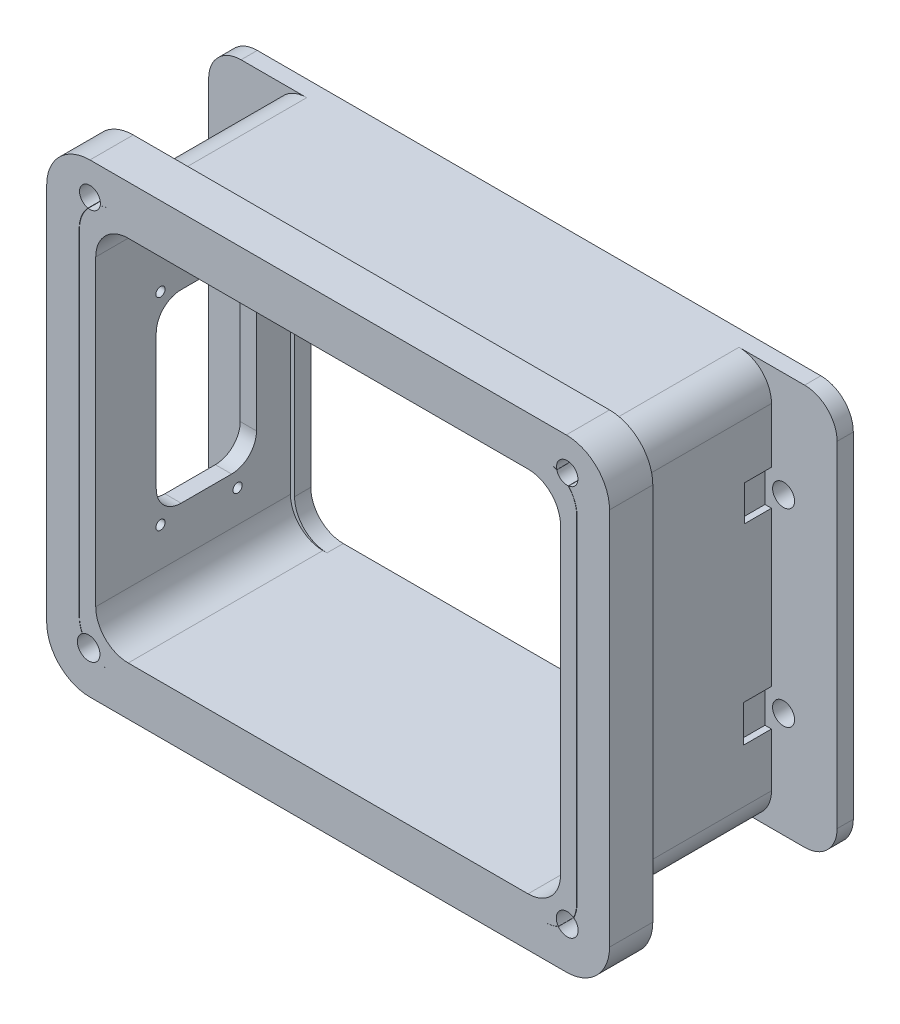
from build123d import *

# Parameters (mm, degrees)
BOSS_EXTRUDE1_DEPTH = 3.81
BOSS_EXTRUDE2_DEPTH = 45.72
CUT_EXTRUDE1_REACH  = 100.694
SKETCH4_R           = 2.58
CUT_EXTRUDE2_REACH  = 150.732
CUT_EXTRUDE3_REACH  = 147.358
SKETCH8_R           = 1.085
SKETCH10_W          = 6.281419417
SKETCH10_H          = 8.338567611
SKETCH10_W_2        = 6.611751911
SKETCH10_H_2        = 8.662901092
CUT_EXTRUDE4_DEPTH  = 1.524
BOSS_EXTRUDE3_DEPTH = 10.16
SKETCH12_R          = 2.447521694
SKETCH12_R_2        = 2.570723965
SKETCH12_R_3        = 2.649131916
SKETCH12_R_4        = 2.514751493
CUT_EXTRUDE5_DEPTH  = 5.08


with BuildPart() as part:
    # Sketch1 → Boss-Extrude1 (new body)
    with BuildSketch(Plane.XY):
        with BuildLine():
            Line((66.150214266, -46.99), (-66.150214266, -46.99))
            ThreePointArc((-66.150214266, -46.99), (-71.538367938, -44.758153673), (-73.770214266, -39.37))
            Line((-73.770214266, -39.37), (-73.770214266, 39.37))
            ThreePointArc((-73.770214266, 39.37), (-71.538367938, 44.758153673), (-66.150214266, 46.99))
            Line((-66.150214266, 46.99), (66.150214266, 46.99))
            ThreePointArc((66.150214266, 46.99), (71.538367938, 44.758153673), (73.770214266, 39.37))
            Line((73.770214266, 39.37), (73.770214266, -39.37))
            ThreePointArc((73.770214266, -39.37), (71.538367938, -44.758153673), (66.150214266, -46.99))
        make_face()
        with BuildLine():
            Line((45.974935849, -43.18), (-45.974935849, -43.18))
            ThreePointArc((-45.974935849, -43.18), (-51.363089522, -40.948153673), (-53.594935849, -35.56))
            Line((-53.594935849, -35.56), (-53.594935849, 35.56))
            ThreePointArc((-53.594935849, 35.56), (-51.363089522, 40.948153673), (-45.974935849, 43.18))
            Line((-45.974935849, 43.18), (45.974935849, 43.18))
            ThreePointArc((45.974935849, 43.18), (51.363089522, 40.948153673), (53.594935849, 35.56))
            Line((53.594935849, 35.56), (53.594935849, -35.56))
            ThreePointArc((53.594935849, -35.56), (51.363089522, -40.948153673), (45.974935849, -43.18))
        make_face(mode=Mode.SUBTRACT)
    extrude(amount=BOSS_EXTRUDE1_DEPTH)

    # Sketch2 → Boss-Extrude2 (add)
    with BuildSketch(Plane.XY.offset(3.81)):
        with BuildLine():
            Line((50.745873235, -46.99), (-50.745873235, -46.99))
            ThreePointArc((-50.745873235, -46.99), (-56.134026908, -44.758153673), (-58.365873235, -39.37))
            Line((-58.365873235, -39.37), (-58.365873235, 39.37))
            ThreePointArc((-58.365873235, 39.37), (-56.134026908, 44.758153673), (-50.745873235, 46.99))
            Line((-50.745873235, 46.99), (50.745873235, 46.99))
            ThreePointArc((50.745873235, 46.99), (56.134026908, 44.758153673), (58.365873235, 39.37))
            Line((58.365873235, 39.37), (58.365873235, -39.37))
            ThreePointArc((58.365873235, -39.37), (56.134026908, -44.758153673), (50.745873235, -46.99))
        make_face()
        with BuildLine():
            Line((46.935873235, -43.18), (-46.935873235, -43.18))
            ThreePointArc((-46.935873235, -43.18), (-52.324026908, -40.948153673), (-54.555873235, -35.56))
            Line((-54.555873235, -35.56), (-54.555873235, 35.56))
            ThreePointArc((-54.555873235, 35.56), (-52.324026908, 40.948153673), (-46.935873235, 43.18))
            Line((-46.935873235, 43.18), (46.935873235, 43.18))
            ThreePointArc((46.935873235, 43.18), (52.324026908, 40.948153673), (54.555873235, 35.56))
            Line((54.555873235, 35.56), (54.555873235, -35.56))
            ThreePointArc((54.555873235, -35.56), (52.324026908, -40.948153673), (46.935873235, -43.18))
        make_face(mode=Mode.SUBTRACT)
    extrude(amount=BOSS_EXTRUDE2_DEPTH)

    # Sketch4 → Cut-Extrude1 (cut, up to next)
    with BuildSketch(Plane.XY.offset(3.81), mode=Mode.PRIVATE) as cut_extrude1_sk1:
        with Locations((61.206014266, 22.22917718)):
            Circle(SKETCH4_R)
    cut_extrude1_tool1 = extrude(cut_extrude1_sk1.sketch, amount=-CUT_EXTRUDE1_REACH, mode=Mode.PRIVATE) & part.part
    # Sketch4 → Cut-Extrude1 (cut, up to next)
    with BuildSketch(Plane.XY.offset(3.81), mode=Mode.PRIVATE) as cut_extrude1_sk2:
        with Locations((61.206005964, -22.22082282)):
            Circle(SKETCH4_R)
    cut_extrude1_tool2 = extrude(cut_extrude1_sk2.sketch, amount=-CUT_EXTRUDE1_REACH, mode=Mode.PRIVATE) & part.part
    # Sketch4 → Cut-Extrude1 (cut, up to next)
    with BuildSketch(Plane.XY.offset(3.81), mode=Mode.PRIVATE) as cut_extrude1_sk3:
        with Locations((-60.973994036, -22.2208)):
            Circle(SKETCH4_R)
    cut_extrude1_tool3 = extrude(cut_extrude1_sk3.sketch, amount=-CUT_EXTRUDE1_REACH, mode=Mode.PRIVATE) & part.part
    # Sketch4 → Cut-Extrude1 (cut, up to next)
    with BuildSketch(Plane.XY.offset(3.81), mode=Mode.PRIVATE) as cut_extrude1_sk4:
        with Locations((-60.973985734, 22.2292)):
            Circle(SKETCH4_R)
    cut_extrude1_tool4 = extrude(cut_extrude1_sk4.sketch, amount=-CUT_EXTRUDE1_REACH, mode=Mode.PRIVATE) & part.part
    add(cut_extrude1_tool1.solids().sort_by_distance((61.206014, 22.229177, 3.81))[0], mode=Mode.SUBTRACT)
    add(cut_extrude1_tool2.solids().sort_by_distance((61.206006, -22.220823, 3.81))[0], mode=Mode.SUBTRACT)
    add(cut_extrude1_tool3.solids().sort_by_distance((-60.973994, -22.2208, 3.81))[0], mode=Mode.SUBTRACT)
    add(cut_extrude1_tool4.solids().sort_by_distance((-60.973986, 22.2292, 3.81))[0], mode=Mode.SUBTRACT)

    # Sketch7 → Cut-Extrude2 (cut, up to next)
    with BuildSketch(Plane.ZY.offset(58.365873235), mode=Mode.PRIVATE) as cut_extrude2_sk1:
        with BuildLine():
            Line((11.791283781, 13.03362733), (11.791283781, -18.68237267))
            ThreePointArc((11.791283781, -18.68237267), (13.502365966, -22.813290486), (17.633283781, -24.52437267))
            Line((17.633283781, -24.52437267), (29.481979429, -24.52437267))
            ThreePointArc((29.481979429, -24.52437267), (33.612897244, -22.813290486), (35.323979429, -18.68237267))
            Line((35.323979429, -18.68237267), (35.323979429, 13.03362733))
            ThreePointArc((35.323979429, 13.03362733), (33.612897244, 17.164545145), (29.481979429, 18.87562733))
            Line((29.481979429, 18.87562733), (17.633283781, 18.87562733))
            ThreePointArc((17.633283781, 18.87562733), (13.502365966, 17.164545145), (11.791283781, 13.03362733))
        make_face()
    cut_extrude2_tool1 = extrude(cut_extrude2_sk1.sketch, amount=-CUT_EXTRUDE2_REACH, mode=Mode.PRIVATE) & part.part
    add(cut_extrude2_tool1.solids().sort_by_distance((-58.365873, -2.824373, 23.557632))[0], mode=Mode.SUBTRACT)

    # Sketch8 → Cut-Extrude3 (cut, up to next)
    with BuildSketch(Plane(origin=(-54.555873235, 0, 0), x_dir=(0, 0, -1), z_dir=(1, 0, 0)), mode=Mode.PRIVATE) as cut_extrude3_sk1:
        with Locations(Location((-34.323979429, -26.52437267, 0), (0, 0, 90))):
            Circle(SKETCH8_R)
    cut_extrude3_tool1 = extrude(cut_extrude3_sk1.sketch, amount=-CUT_EXTRUDE3_REACH, mode=Mode.PRIVATE) & part.part
    # Sketch8 → Cut-Extrude3 (cut, up to next)
    with BuildSketch(Plane(origin=(-54.555873235, 0, 0), x_dir=(0, 0, -1), z_dir=(1, 0, 0)), mode=Mode.PRIVATE) as cut_extrude3_sk2:
        with Locations(Location((-16.223979429, -28.02437267, 0), (0, 0, 90))):
            Circle(SKETCH8_R)
    cut_extrude3_tool2 = extrude(cut_extrude3_sk2.sketch, amount=-CUT_EXTRUDE3_REACH, mode=Mode.PRIVATE) & part.part
    # Sketch8 → Cut-Extrude3 (cut, up to next)
    with BuildSketch(Plane(origin=(-54.555873235, 0, 0), x_dir=(0, 0, -1), z_dir=(1, 0, 0)), mode=Mode.PRIVATE) as cut_extrude3_sk3:
        with Locations(Location((-16.223979429, 22.37562733, 0), (0, 0, 90))):
            Circle(SKETCH8_R)
    cut_extrude3_tool3 = extrude(cut_extrude3_sk3.sketch, amount=-CUT_EXTRUDE3_REACH, mode=Mode.PRIVATE) & part.part
    # Sketch8 → Cut-Extrude3 (cut, up to next)
    with BuildSketch(Plane(origin=(-54.555873235, 0, 0), x_dir=(0, 0, -1), z_dir=(1, 0, 0)), mode=Mode.PRIVATE) as cut_extrude3_sk4:
        with Locations(Location((-34.323979429, 20.87562733, 0), (0, 0, 90))):
            Circle(SKETCH8_R)
    cut_extrude3_tool4 = extrude(cut_extrude3_sk4.sketch, amount=-CUT_EXTRUDE3_REACH, mode=Mode.PRIVATE) & part.part
    add(cut_extrude3_tool1.solids().sort_by_distance((-54.555873, -26.524373, 34.323979))[0], mode=Mode.SUBTRACT)
    add(cut_extrude3_tool2.solids().sort_by_distance((-54.555873, -28.024373, 16.223979))[0], mode=Mode.SUBTRACT)
    add(cut_extrude3_tool3.solids().sort_by_distance((-54.555873, 22.375627, 16.223979))[0], mode=Mode.SUBTRACT)
    add(cut_extrude3_tool4.solids().sort_by_distance((-54.555873, 20.875627, 34.323979))[0], mode=Mode.SUBTRACT)

    # Sketch10 → Cut-Extrude4 (cut)
    with BuildSketch(Plane.ZY.offset(58.365873235)):
        with Locations((6.950709709, 22.241628059)):
            Rectangle(SKETCH10_W, SKETCH10_H)
        with Locations((7.115875956, -22.482023984)):
            Rectangle(SKETCH10_W_2, SKETCH10_H_2)
    cut_extrude4 = extrude(amount=-CUT_EXTRUDE4_DEPTH, mode=Mode.SUBTRACT)

    # Mirror1: Cut-Extrude4 across plane
    add(cut_extrude4.mirror(Plane.ZY), mode=Mode.SUBTRACT)

    # Sketch11 → Boss-Extrude3 (add)
    with BuildSketch(Plane.XY.offset(49.53)):
        with BuildLine():
            Line((55.90804375, -54.61), (-55.90804375, -54.61))
            ThreePointArc((-55.90804375, -54.61), (-63.092248647, -51.634204897), (-66.06804375, -44.45))
            Line((-66.06804375, -44.45), (-66.06804375, 44.45))
            ThreePointArc((-66.06804375, 44.45), (-63.092248647, 51.634204897), (-55.90804375, 54.61))
            Line((-55.90804375, 54.61), (55.90804375, 54.61))
            ThreePointArc((55.90804375, 54.61), (63.092248647, 51.634204897), (66.06804375, 44.45))
            Line((66.06804375, 44.45), (66.06804375, -44.45))
            ThreePointArc((66.06804375, -44.45), (63.092248647, -51.634204897), (55.90804375, -54.61))
        make_face()
        with BuildLine():
            Line((50.82804375, -46.99), (-50.82804375, -46.99))
            ThreePointArc((-50.82804375, -46.99), (-56.216197423, -44.758153673), (-58.44804375, -39.37))
            Line((-58.44804375, -39.37), (-58.44804375, 39.37))
            ThreePointArc((-58.44804375, 39.37), (-56.216197423, 44.758153673), (-50.82804375, 46.99))
            Line((-50.82804375, 46.99), (50.82804375, 46.99))
            ThreePointArc((50.82804375, 46.99), (56.216197423, 44.758153673), (58.44804375, 39.37))
            Line((58.44804375, 39.37), (58.44804375, -39.37))
            ThreePointArc((58.44804375, -39.37), (56.216197423, -44.758153673), (50.82804375, -46.99))
        make_face(mode=Mode.SUBTRACT)
    extrude(amount=-BOSS_EXTRUDE3_DEPTH)

    # Sketch12 → Cut-Extrude5 (cut)
    with BuildSketch(Plane.XY.offset(49.53)):
        with Locations((-55.90804375, 46.99)):
            Circle(SKETCH12_R)
        with Locations((56.134026908, -44.758153673)):
            Circle(SKETCH12_R_2)
        with Locations((-56.216197423, -44.758153673)):
            Circle(SKETCH12_R_3)
        with Locations((56.134026908, 46.99)):
            Circle(SKETCH12_R_4)
    extrude(amount=-CUT_EXTRUDE5_DEPTH, mode=Mode.SUBTRACT)


solid = part.part
